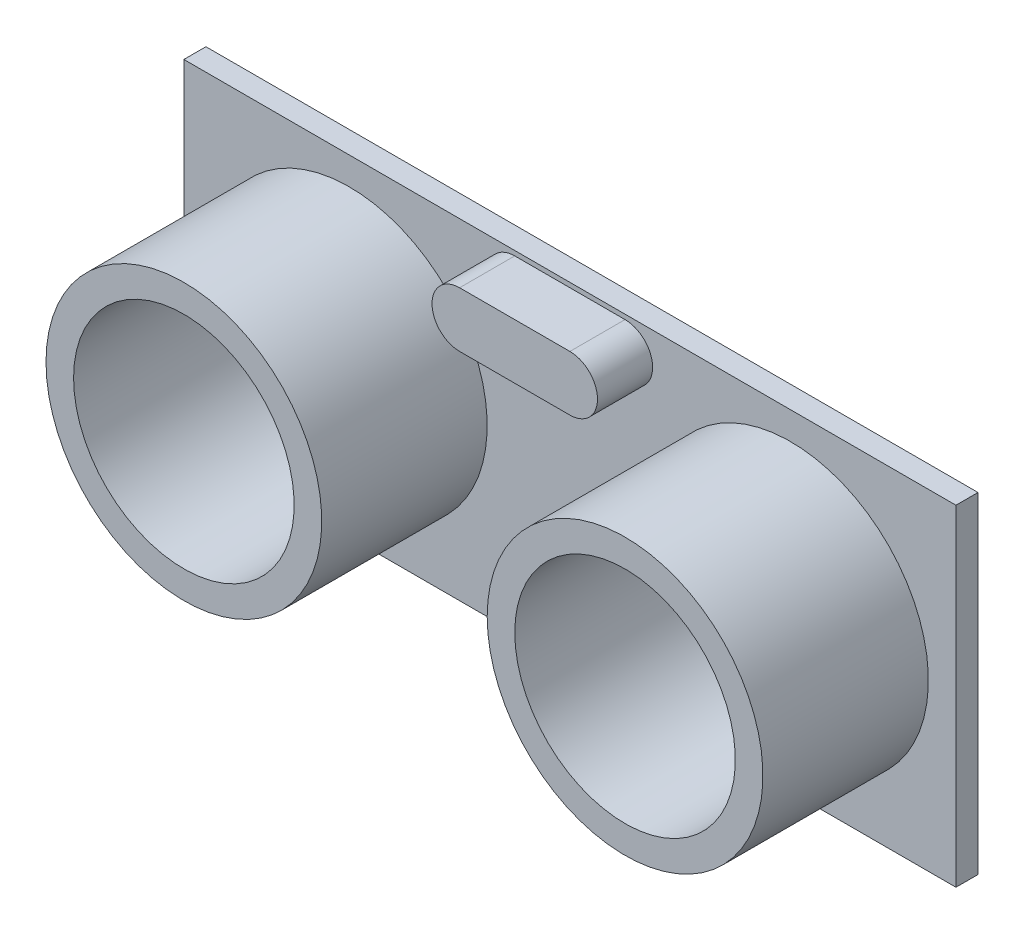
from build123d import *

# Parameters (mm, degrees)
SKETCH1_W           = 44.45
SKETCH1_H           = 19.05
BOSS_EXTRUDE1_DEPTH = 1.27
SKETCH2_R           = 7.9375
SKETCH2_R_2         = 6.35
BOSS_EXTRUDE2_DEPTH = 9.525
SKETCH4_W           = 9.525
SKETCH4_H           = 1.5875
BOSS_EXTRUDE3_DEPTH = 1.5875
SKETCH5_R           = 0.396875
BOSS_EXTRUDE4_DEPTH = 6.35
BOSS_EXTRUDE5_DEPTH = 3.175


with BuildPart() as part:
    # Sketch1 → Boss-Extrude1 (new body)
    with BuildSketch(Plane.XY):
        Rectangle(SKETCH1_W, SKETCH1_H)
    extrude(amount=BOSS_EXTRUDE1_DEPTH)

    # Sketch2 → Boss-Extrude2 (add)
    # profile 1 of 2: a face of its own
    with BuildSketch(Plane.XY.offset(1.27)):
        with Locations((12.7, 0)):
            Circle(SKETCH2_R)
        with Locations((12.7, 0)):
            Circle(SKETCH2_R_2, mode=Mode.SUBTRACT)
    # profile 2 of 2: a face of its own
    with BuildSketch(Plane.XY.offset(1.27)):
        with Locations((-12.7, 0)):
            Circle(SKETCH2_R)
        with Locations((-12.7, 0)):
            Circle(SKETCH2_R_2, mode=Mode.SUBTRACT)
    extrude(amount=BOSS_EXTRUDE2_DEPTH)

    # Sketch4 → Boss-Extrude3 (add)
    with BuildSketch(Plane(origin=(0, 0, 0), x_dir=(-1, 0, 0), z_dir=(0, 0, -1))):
        with Locations((-0.089489862, -8.73125)):
            Rectangle(SKETCH4_W, SKETCH4_H)
    extrude(amount=BOSS_EXTRUDE3_DEPTH)

    # Sketch5 → Boss-Extrude4 (add)
    with BuildSketch(Plane.XZ.offset(9.525)):
        with Locations((-3.548073308, -0.79375)):
            Circle(SKETCH5_R)
        with Locations((-1.008073308, -0.79375)):
            Circle(SKETCH5_R)
        with Locations((1.531926692, -0.79375)):
            Circle(SKETCH5_R)
        with Locations((4.071926692, -0.79375)):
            Circle(SKETCH5_R)
    extrude(amount=BOSS_EXTRUDE4_DEPTH)

    # Sketch6 → Boss-Extrude5 (add)
    with BuildSketch(Plane.XY.offset(1.27)):
        with BuildLine():
            ThreePointArc((-3.175, 9.254970204), (-4.7625, 7.667470204), (-3.175, 6.079970204))
            Line((-3.175, 6.079970204), (3.175, 6.079970204))
            ThreePointArc((3.175, 6.079970204), (4.7625, 7.667470204), (3.175, 9.254970204))
            Line((3.175, 9.254970204), (-3.175, 9.254970204))
        make_face()
    extrude(amount=BOSS_EXTRUDE5_DEPTH)


solid = part.part
